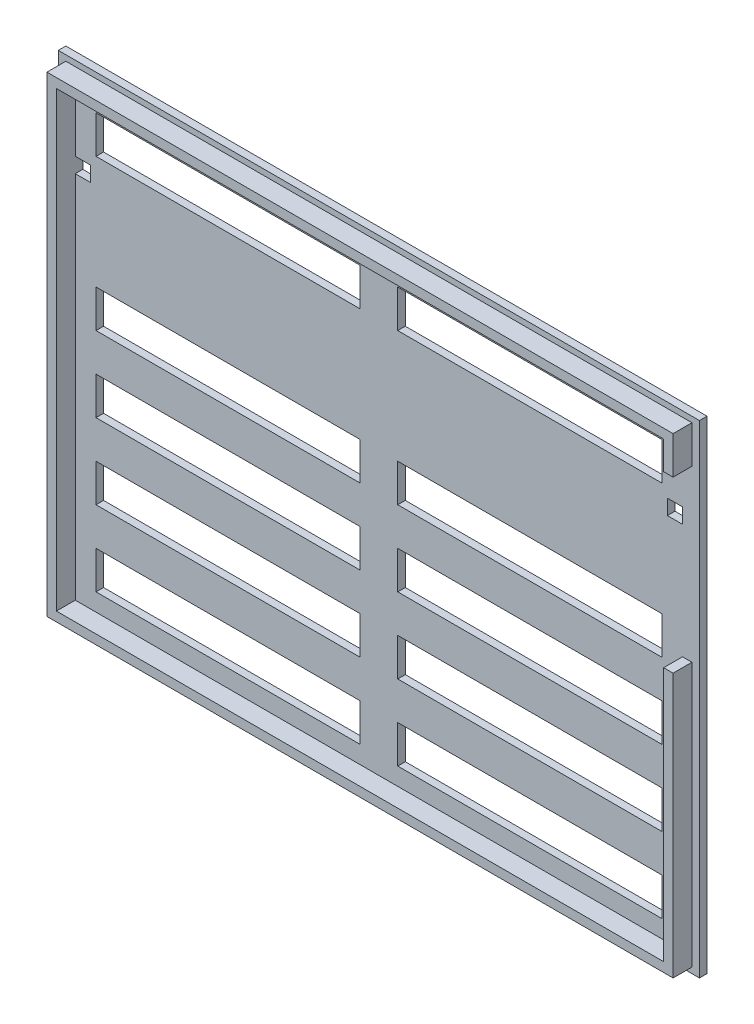
from build123d import *

# Parameters (mm, degrees)
SKETCH_3_W          = 170
SKETCH_3_H          = 128
EXTRUDE_2_DEPTH     = 2
SKETCH_4_W          = 166
SKETCH_4_H          = 125
EXTRUDE_3_DEPTH     = 5
CUT_EXTRUDE_1_DEPTH = 5
SKETCH_7_W          = 70
SKETCH_7_H          = 10
CUT_EXTRUDE_3_DEPTH = 107.517604179
SKETCH_6_W          = 4
SKETCH_6_H          = 4
CUT_EXTRUDE_4_DEPTH = 107.630202101


with BuildPart() as part:
    # 草图3 → 凸台-拉伸2 (new body)
    with BuildSketch(Plane.XY):
        Rectangle(SKETCH_3_W, SKETCH_3_H)
    extrude(amount=EXTRUDE_2_DEPTH)

    # 草图4 → 凸台-拉伸3 (add)
    with BuildSketch(Plane.XY.offset(2)):
        Rectangle(SKETCH_4_W, SKETCH_4_H)
    extrude(amount=EXTRUDE_3_DEPTH)

    # 草图5 → 切除-拉伸1 (cut)
    with BuildSketch(Plane.XY.offset(7)):
        Polygon((-80.5, 60), (80.5, 60), (80.5, 52.5), (83, 52.5), (83, 7.5), (80.5, 7.5), (80.5, -60), (-80.5, -60), align=None)
    extrude(amount=-CUT_EXTRUDE_1_DEPTH, mode=Mode.SUBTRACT)

    # 草图7 → 切除-拉伸3 (cut, through all)
    with BuildSketch(Plane.XY.offset(2)):
        with Locations((-40, -50.337089846)):
            Rectangle(SKETCH_7_W, SKETCH_7_H)
        with Locations((40, -50.337089846)):
            Rectangle(SKETCH_7_W, SKETCH_7_H)
        with Locations((-40, -30.337089846)):
            Rectangle(SKETCH_7_W, SKETCH_7_H)
        with Locations((40, -30.337089846)):
            Rectangle(SKETCH_7_W, SKETCH_7_H)
        with Locations((-40, -10.337089846)):
            Rectangle(SKETCH_7_W, SKETCH_7_H)
        with Locations((40, -10.337089846)):
            Rectangle(SKETCH_7_W, SKETCH_7_H)
        with Locations((-40, 9.662910154)):
            Rectangle(SKETCH_7_W, SKETCH_7_H)
        with Locations((40, 9.662910154)):
            Rectangle(SKETCH_7_W, SKETCH_7_H)
        with Locations((-40, 49.662910154)):
            Rectangle(SKETCH_7_W, SKETCH_7_H)
        with Locations((40, 49.662910154)):
            Rectangle(SKETCH_7_W, SKETCH_7_H)
    extrude(amount=-CUT_EXTRUDE_3_DEPTH, mode=Mode.SUBTRACT)

    # 草图6 → 切除-拉伸4 (cut, through all)
    with BuildSketch(Plane(origin=(0, 0, 0), x_dir=(-1, 0, 0), z_dir=(0, 0, -1))):
        with Locations((-78.5, 39.93)):
            Rectangle(SKETCH_6_W, SKETCH_6_H)
        with Locations((78.5, 39.93)):
            Rectangle(SKETCH_6_W, SKETCH_6_H)
    extrude(amount=-CUT_EXTRUDE_4_DEPTH, mode=Mode.SUBTRACT)


solid = part.part
